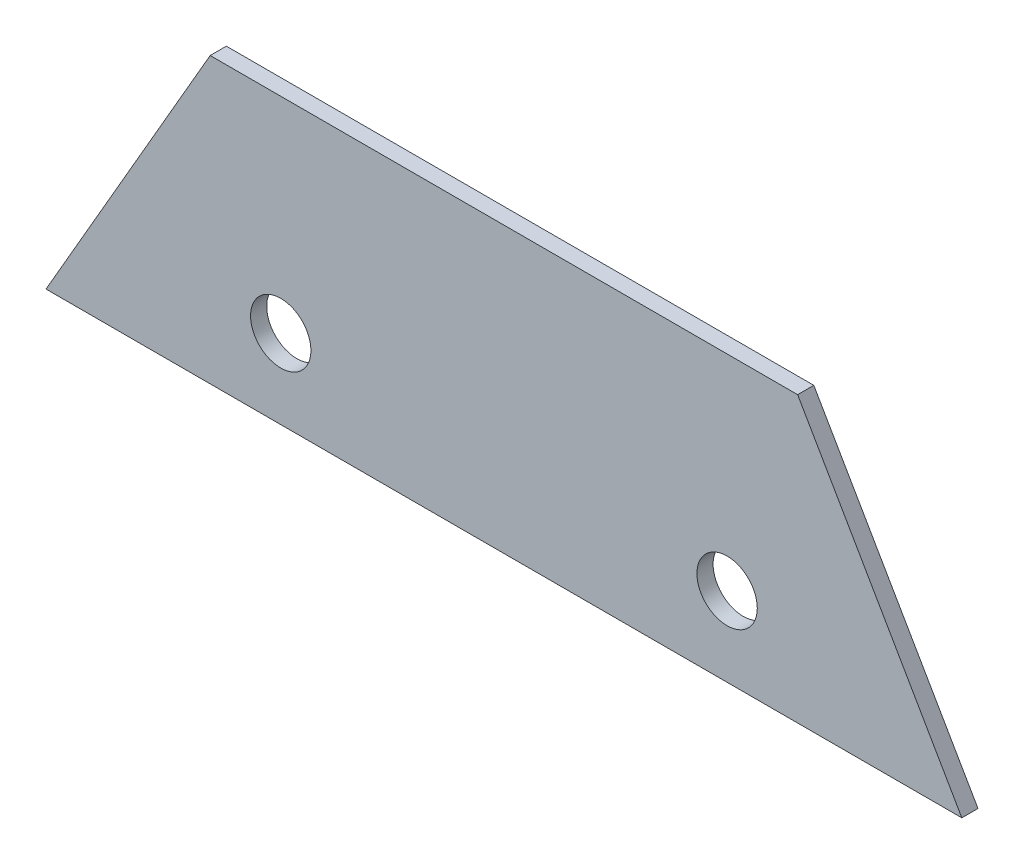
from build123d import *

# Parameters (mm, degrees)
BOSS_EXTRUDE1_DEPTH = 11.90625
SKETCH2_R           = 22.225
CUT_EXTRUDE1_DEPTH  = 675.334979616


with BuildPart() as part:
    # Sketch1 → Boss-Extrude1 (new body)
    with BuildSketch(Plane.XY):
        Polygon((-337.114930678, -583.900187925), (-216.238948081, -374.536844651), (216.238948081, -374.536844651), (337.114930678, -583.900187925), align=None)
    extrude(amount=-BOSS_EXTRUDE1_DEPTH)

    # Sketch2 → Cut-Extrude1 (cut, through all)
    with BuildSketch(Plane.XY):
        with Locations((-164.309496882, -525.607187925)):
            Circle(SKETCH2_R)
        with Locations((164.309496882, -525.607187925)):
            Circle(SKETCH2_R)
    extrude(amount=-CUT_EXTRUDE1_DEPTH, mode=Mode.SUBTRACT)


solid = part.part
